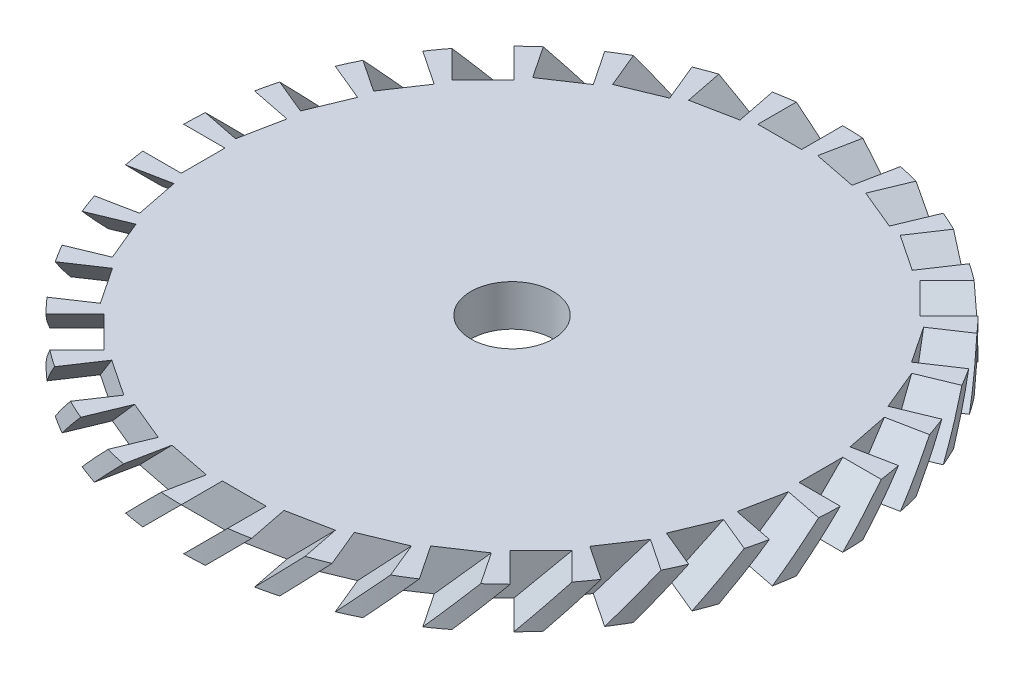
from build123d import *

# Parameters (mm, degrees)
SKETCH1_R           = 50.8
SKETCH1_R_2         = 6.35
BOSS_EXTRUDE1_DEPTH = 6.35
CUT_EXTRUDE1_DEPTH  = 6.35
CIRPATTERN1_COUNT   = 32


with BuildPart() as part:
    # Sketch1 → Boss-Extrude1 (new body)
    with BuildSketch(Plane(origin=(0, 0, 0), x_dir=(1, 0, 0), z_dir=(0, 1, 0))):
        with Locations(Location((0, 0, 0), (0, 0, 270))):
            Circle(SKETCH1_R)
        with Locations(Location((0, 0, 0), (0, 0, 270))):
            Circle(SKETCH1_R_2, mode=Mode.SUBTRACT)
    extrude(amount=BOSS_EXTRUDE1_DEPTH)

    # Sketch2 → Cut-Extrude1 (cut)
    with BuildSketch(Plane.XY.offset(50.8)):
        Polygon((15.154182204, 14.961586159), (-11.786586159, -11.979182204), (-15.154182204, -8.611586159), (11.786586159, 18.329182204), align=None)
    cut_extrude1 = extrude(amount=-CUT_EXTRUDE1_DEPTH, mode=Mode.SUBTRACT)

    # CirPattern1: Cut-Extrude1 ×32 about axis
    cirpattern1_axis = Axis((0, 0, 0), (0, 1, 0))
    for i in range(1, CIRPATTERN1_COUNT):
        add(cut_extrude1.rotate(cirpattern1_axis, i * 360 / CIRPATTERN1_COUNT), mode=Mode.SUBTRACT)


solid = part.part
